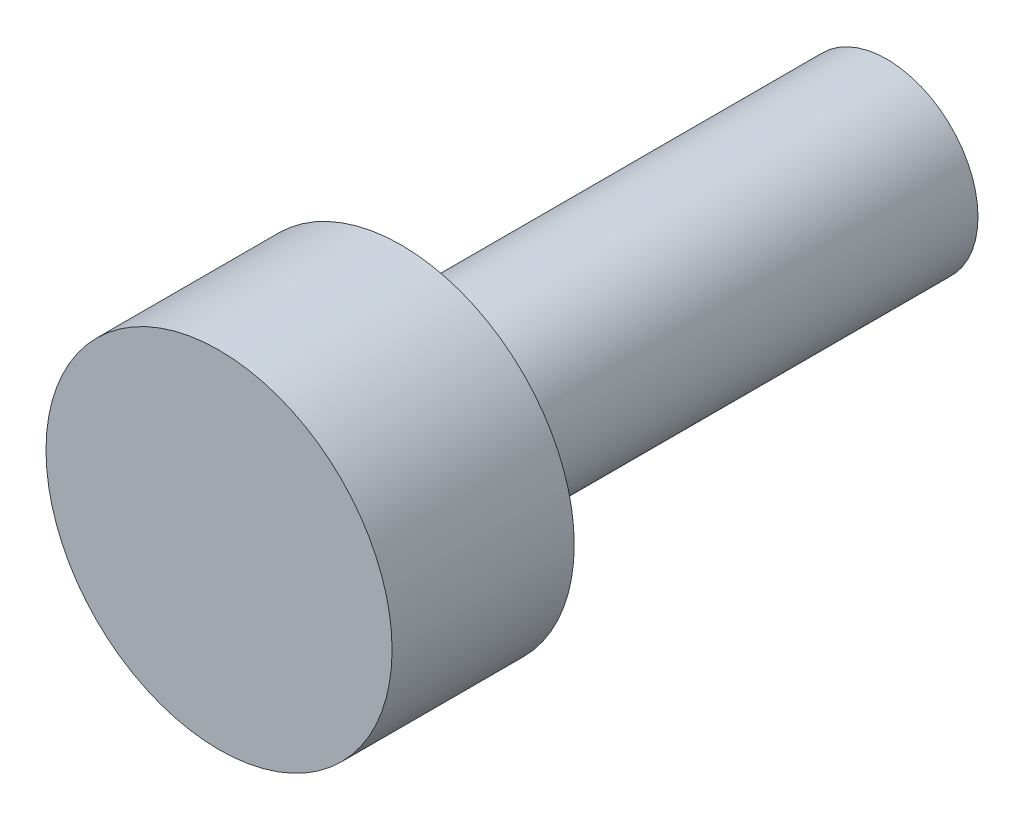
from build123d import *

# Parameters (mm, degrees)
SKETCH1_R           = 1.5
BOSS_EXTRUDE1_DEPTH = 8
SKETCH2_R           = 2.85
BOSS_EXTRUDE2_DEPTH = 3


with BuildPart() as part:
    # Sketch1 → Boss-Extrude1 (new body)
    with BuildSketch(Plane.XY):
        Circle(SKETCH1_R)
    extrude(amount=BOSS_EXTRUDE1_DEPTH)

    # Sketch2 → Boss-Extrude2 (add)
    with BuildSketch(Plane.XY.offset(8)):
        Circle(SKETCH2_R)
    extrude(amount=BOSS_EXTRUDE2_DEPTH)


solid = part.part
